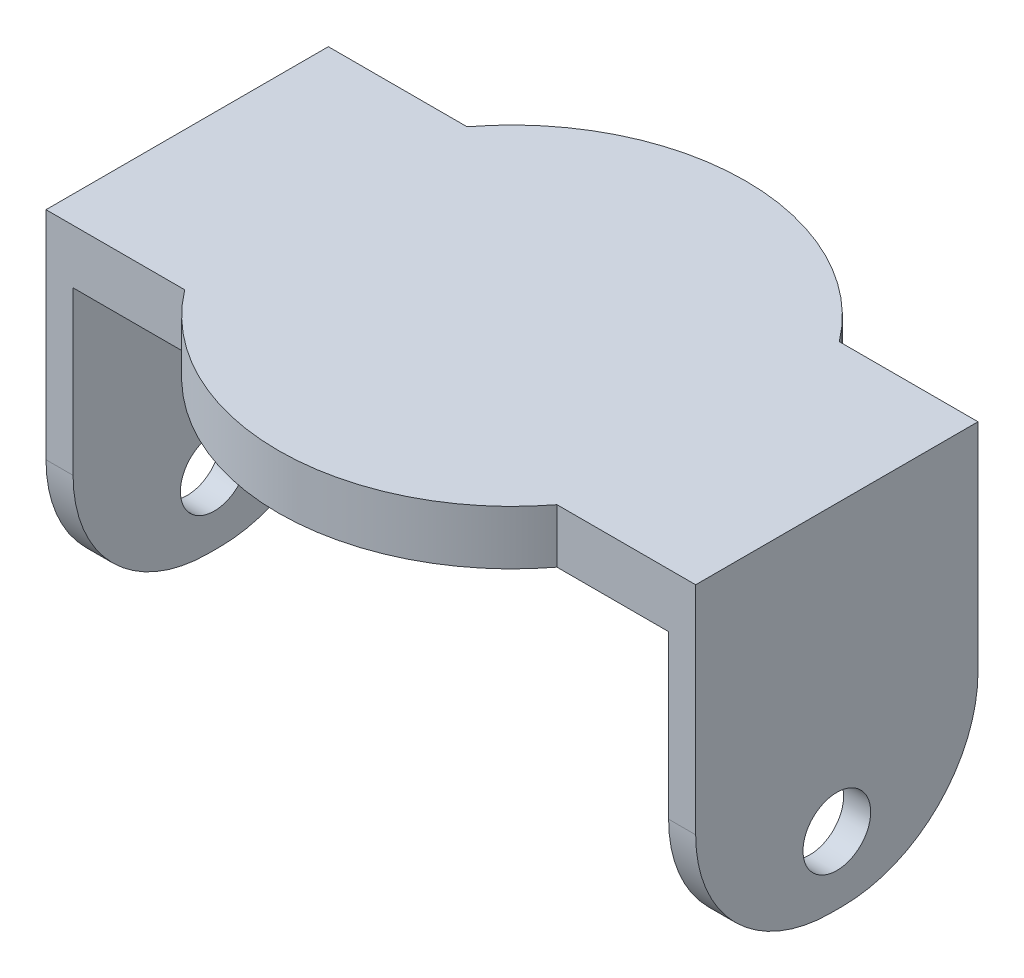
from build123d import *

# Parameters (mm, degrees)
CROQUIS1_W              = 48
CROQUIS1_H              = 46
SALIENTE_EXTRUIR1_DEPTH = 26
CROQUIS2_W              = 44
CROQUIS2_H              = 22
CORTAR_EXTRUIR1_DEPTH   = 46
CROQUIS3_W              = 12.57
CROQUIS3_H              = 22
CORTAR_EXTRUIR3_DEPTH   = 60.236812878
REDONDEO3_R             = 10
REDONDEO4_R             = 10
CROQUIS16_W             = 12.57
CROQUIS16_H             = 4
CORTAR_EXTRUIR19_DEPTH  = 10.25
CROQUIS21_W             = 12.57
CROQUIS21_H             = 4
CORTAR_EXTRUIR20_DEPTH  = 10.25
CORTAR_EXTRUIR21_DEPTH  = 10.25
CROQUIS23_R             = 2.5
CORTAR_EXTRUIR22_DEPTH  = 53


with BuildPart() as part:
    # Croquis1 → Saliente-Extruir1 (new body)
    with BuildSketch(Plane(origin=(0, 0, 0), x_dir=(1, 0, 0), z_dir=(0, 1, 0))):
        Rectangle(CROQUIS1_W, CROQUIS1_H)
    extrude(amount=-SALIENTE_EXTRUIR1_DEPTH)

    # Croquis2 → Cortar-Extruir1 (cut)
    with BuildSketch(Plane.XY.offset(23)):
        with Locations((0, -15)):
            Rectangle(CROQUIS2_W, CROQUIS2_H)
    extrude(amount=-CORTAR_EXTRUIR1_DEPTH, mode=Mode.SUBTRACT)

    # Croquis3 → Cortar-Extruir3 (cut, through all)
    with BuildSketch(Plane(origin=(24, 0, 0), x_dir=(0, 0, -1), z_dir=(1, 0, 0))):
        with Locations((-16.715, -15)):
            Rectangle(CROQUIS3_W, CROQUIS3_H)
        with Locations((16.715, -15)):
            Rectangle(CROQUIS3_W, CROQUIS3_H)
    extrude(amount=-CORTAR_EXTRUIR3_DEPTH, mode=Mode.SUBTRACT)

    # Redondeo3
    redondeo3_edges = [part.edges().sort_by_distance(p)[0] for p in [
        (23, -26, 10.43),
        (23, -26, -10.43),
    ]]
    fillet(redondeo3_edges, radius=REDONDEO3_R)

    # Redondeo4
    redondeo4_edges = [part.edges().sort_by_distance(p)[0] for p in [
        (-23, -26, 10.43),
        (-23, -26, -10.43),
    ]]
    fillet(redondeo4_edges, radius=REDONDEO4_R)

    # Croquis16 → Cortar-Extruir19 (cut)
    with BuildSketch(Plane.ZY.offset(24)):
        with Locations((-16.715, -2)):
            Rectangle(CROQUIS16_W, CROQUIS16_H)
        with Locations((16.715, -2)):
            Rectangle(CROQUIS16_W, CROQUIS16_H)
    extrude(amount=-CORTAR_EXTRUIR19_DEPTH, mode=Mode.SUBTRACT)

    # Croquis21 → Cortar-Extruir20 (cut)
    with BuildSketch(Plane(origin=(24, 0, 0), x_dir=(0, 0, -1), z_dir=(1, 0, 0))):
        with Locations((-16.715, -2)):
            Rectangle(CROQUIS21_W, CROQUIS21_H)
        with Locations((16.715, -2)):
            Rectangle(CROQUIS21_W, CROQUIS21_H)
    extrude(amount=-CORTAR_EXTRUIR20_DEPTH, mode=Mode.SUBTRACT)

    # Croquis22 → Cortar-Extruir21 (cut)
    with BuildSketch(Plane(origin=(0, 0, 0), x_dir=(1, 0, 0), z_dir=(0, 1, 0))):
        with BuildLine():
            Line((13.75, -10.43), (13.75, -23))
            Line((13.75, -23), (-13.75, -23))
            Line((-13.75, -23), (-13.75, -10.43))
            ThreePointArc((-13.75, -10.43), (0, -17.258255995), (13.75, -10.43))
        make_face()
        with BuildLine():
            Line((13.75, 10.43), (13.75, 23))
            Line((13.75, 23), (-13.75, 23))
            Line((-13.75, 23), (-13.75, 10.43))
            ThreePointArc((-13.75, 10.43), (0, 17.258255995), (13.75, 10.43))
        make_face()
    extrude(amount=-CORTAR_EXTRUIR21_DEPTH, mode=Mode.SUBTRACT)

    # Croquis23 → Cortar-Extruir22 (cut)
    with BuildSketch(Plane.ZY.offset(24)):
        with Locations(Location((0, -21, 0), (0, 0, 180))):
            Circle(CROQUIS23_R)
    extrude(amount=-CORTAR_EXTRUIR22_DEPTH, mode=Mode.SUBTRACT)


solid = part.part
